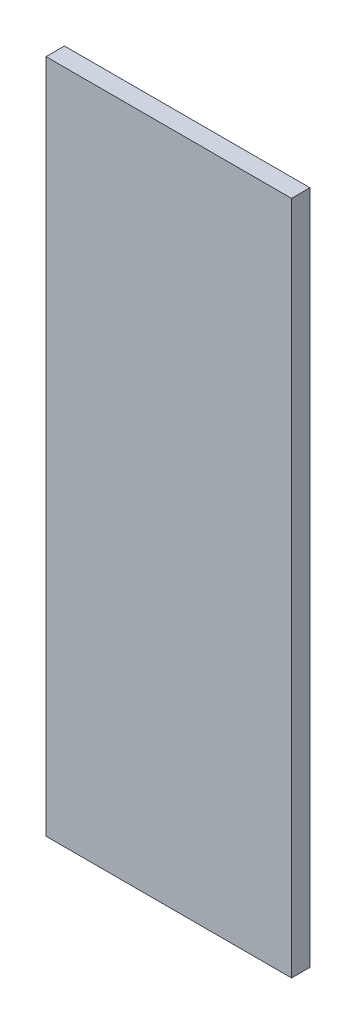
from build123d import *

# Parameters (mm, degrees)
SKETCH_1_W      = 20
SKETCH_1_H      = 55
EXTRUDE_1_DEPTH = 1.5


with BuildPart() as part:
    # 草图1 → 凸台-拉伸1 (new body)
    with BuildSketch(Plane.XY):
        Rectangle(SKETCH_1_W, SKETCH_1_H)
    extrude(amount=EXTRUDE_1_DEPTH)


solid = part.part
